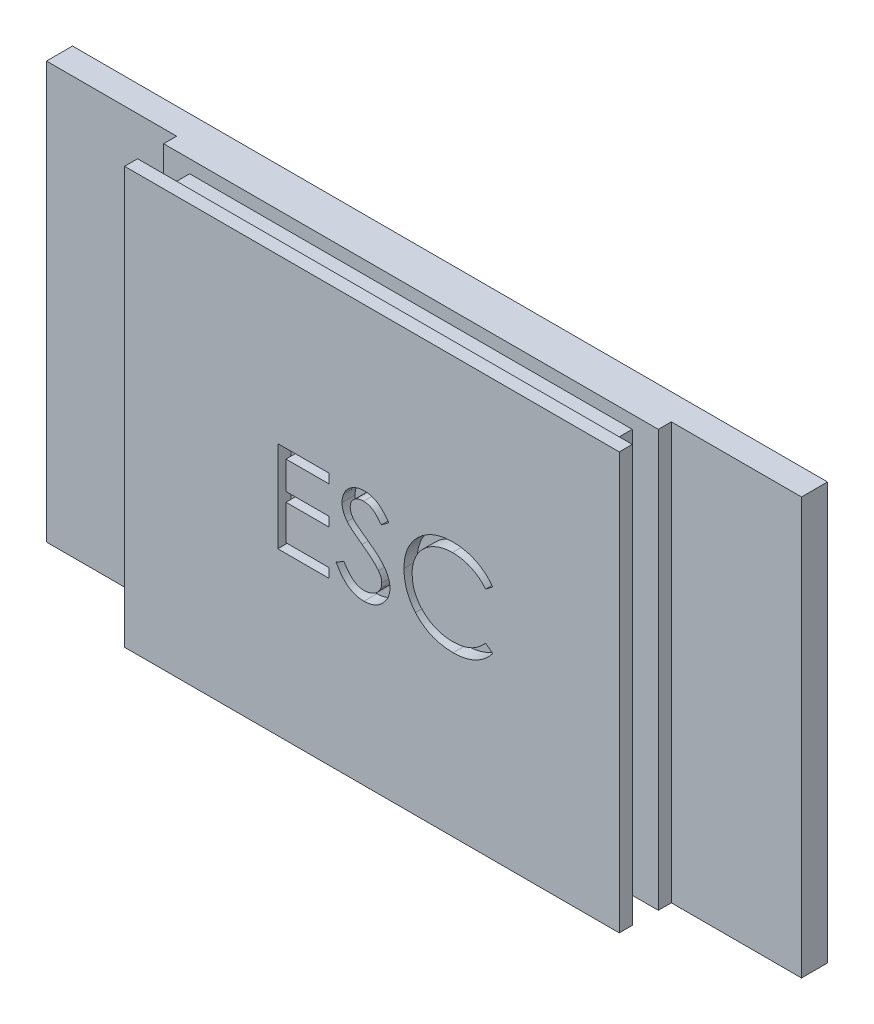
from build123d import *

# Parameters (mm, degrees)
SKETCH1_W           = 29
SKETCH1_H           = 16
BOSS_EXTRUDE2_DEPTH = 1
SKETCH3_W           = 19
SKETCH3_H           = 16
BOSS_EXTRUDE3_DEPTH = 2
SKETCH5_W           = 1
SKETCH5_H           = 16
CUT_EXTRUDE1_DEPTH  = 1
SKETCH7_W           = 1
SKETCH7_H           = 16
CUT_EXTRUDE2_DEPTH  = 1
SKETCH8_W           = 17
SKETCH8_H           = 1
CUT_EXTRUDE3_DEPTH  = 0.5
SKETCH9_W           = 17
SKETCH9_H           = 1
CUT_EXTRUDE4_DEPTH  = 0.5
CUT_EXTRUDE5_DEPTH  = 0.5


with BuildPart() as part:
    # Sketch1 → Boss-Extrude2 (new body)
    with BuildSketch(Plane.XY):
        Rectangle(SKETCH1_W, SKETCH1_H)
    extrude(amount=BOSS_EXTRUDE2_DEPTH)

    # Sketch3 → Boss-Extrude3 (add)
    with BuildSketch(Plane.XY.offset(1)):
        Rectangle(SKETCH3_W, SKETCH3_H)
    extrude(amount=BOSS_EXTRUDE3_DEPTH)

    # Sketch5 → Cut-Extrude1 (cut)
    with BuildSketch(Plane.ZY.offset(9.5)):
        with Locations((2, 0)):
            Rectangle(SKETCH5_W, SKETCH5_H)
    extrude(amount=-CUT_EXTRUDE1_DEPTH, mode=Mode.SUBTRACT)

    # Sketch7 → Cut-Extrude2 (cut)
    with BuildSketch(Plane(origin=(9.5, 0, 0), x_dir=(0, 0, -1), z_dir=(1, 0, 0))):
        with Locations((-2, 0)):
            Rectangle(SKETCH7_W, SKETCH7_H)
    extrude(amount=-CUT_EXTRUDE2_DEPTH, mode=Mode.SUBTRACT)

    # Sketch8 → Cut-Extrude3 (cut)
    with BuildSketch(Plane.XZ.offset(8)):
        with Locations((0, 2)):
            Rectangle(SKETCH8_W, SKETCH8_H)
    extrude(amount=-CUT_EXTRUDE3_DEPTH, mode=Mode.SUBTRACT)

    # Sketch9 → Cut-Extrude4 (cut)
    with BuildSketch(Plane(origin=(0, 8, 0), x_dir=(1, 0, 0), z_dir=(0, 1, 0))):
        with Locations((0, -2)):
            Rectangle(SKETCH9_W, SKETCH9_H)
    extrude(amount=-CUT_EXTRUDE4_DEPTH, mode=Mode.SUBTRACT)

    # Sketch10 → Cut-Extrude5 (cut)
    with BuildSketch(Plane.XY.offset(3)):
        Polygon((-3.615280491, 1.719214215), (-1.640921517, 1.719214215), (-1.640921517, 1.360239856), (-3.301177927, 1.360239856), (-3.301177927, 0.283316779), (-1.640921517, 0.283316779), (-1.640921517, -0.07565758), (-3.301177927, -0.07565758), (-3.301177927, -1.421811426), (-1.640921517, -1.421811426), (-1.640921517, -1.780785785), (-3.615280491, -1.780785785), align=None)
        with BuildLine():
            Line((-1.371690747, -1.105605497), (-1.07581735, -0.928221683))
            add(Edge.make_bspline(
                [(-1.07581735, -0.928221683), (-1.048299113, -0.974286068), (-0.995575232, -1.062543652), (-0.907623873, -1.181801692), (-0.816490962, -1.283163849), (-0.721501628, -1.366040456), (-0.62323568, -1.431289343), (-0.521051626, -1.477491575), (-0.415293816, -1.50630755), (-0.343319994, -1.509807637), (-0.307387863, -1.511555016)],
                knots=[0, 0, 0, 0, 1.272034388, 2.437168799, 3.508375237, 4.49857839, 5.41946034, 6.295179144, 7.148887113, 8, 8, 8, 8], degree=3))
            add(Edge.make_bspline(
                [(-0.307387863, -1.511555016), (-0.276701002, -1.510700344), (-0.215864229, -1.509005953), (-0.126301986, -1.492725151), (-0.039320184, -1.467713022), (0.043288454, -1.431892091), (0.120384068, -1.388553605), (0.187990764, -1.336207428), (0.246436877, -1.277601222), (0.294245991, -1.212218567), (0.330926027, -1.141901419), (0.359118095, -1.069725467), (0.374763169, -0.994556899), (0.377119922, -0.943946436), (0.378309253, -0.918405978)],
                knots=[0, 0, 0, 0, 1.095163259, 2.171163733, 3.241058638, 4.321873601, 5.38011039, 6.391990106, 7.366004449, 8.327778327, 9.272591725, 10.192022065, 11.087607919, 12, 12, 12, 12], degree=3))
            add(Edge.make_bspline(
                [(0.378309253, -0.918405978), (0.376834942, -0.889265128), (0.373837884, -0.830026039), (0.348506404, -0.742626386), (0.308657157, -0.656133816), (0.271894513, -0.60263255), (0.252808451, -0.574856298)],
                knots=[0, 0, 0, 0, 0.938893495, 1.908633276, 2.914225137, 4, 4, 4, 4], degree=3))
            add(Edge.make_bspline(
                [(0.252808451, -0.574856298), (0.237137837, -0.554809475), (0.204239343, -0.512723676), (0.14768183, -0.450078441), (0.081315716, -0.385460022), (0.007412161, -0.316400965), (-0.076720928, -0.246113168), (-0.168448442, -0.17124489), (-0.270112301, -0.094643313), (-0.341411798, -0.043270747), (-0.378201164, -0.016763349)],
                knots=[0, 0, 0, 0, 0.722233717, 1.516239348, 2.393582979, 3.351407094, 4.387010283, 5.505090956, 6.712668013, 8, 8, 8, 8], degree=3))
            add(Edge.make_bspline(
                [(-0.378201164, -0.016763349), (-0.41502516, 0.009465238), (-0.485429837, 0.0596123), (-0.583888419, 0.134036584), (-0.671932882, 0.202080454), (-0.749171899, 0.264384466), (-0.815571496, 0.320957071), (-0.871654907, 0.37125501), (-0.915993464, 0.416638571), (-0.940649044, 0.446079913), (-0.951718792, 0.459298349)],
                knots=[0, 0, 0, 0, 1.452282411, 2.77665338, 3.964542531, 5.026858415, 5.96415736, 6.766646006, 7.446254459, 8, 8, 8, 8], degree=3))
            add(Edge.make_bspline(
                [(-0.951718792, 0.459298349), (-0.967191337, 0.479899386), (-0.997620174, 0.52041409), (-1.03778618, 0.583738948), (-1.071925342, 0.648562213), (-1.098687675, 0.715058078), (-1.121223893, 0.782293006), (-1.136381824, 0.851144252), (-1.145873221, 0.921302871), (-1.146845208, 0.968516371), (-1.147331773, 0.992150913)],
                knots=[0, 0, 0, 0, 1.068054152, 2.10047183, 3.106115577, 4.101338837, 5.06977816, 6.043150881, 7.020423561, 8, 8, 8, 8], degree=3))
            add(Edge.make_bspline(
                [(-1.147331773, 0.992150913), (-1.146026564, 1.029180688), (-1.143444044, 1.102448752), (-1.121603527, 1.209479582), (-1.087130633, 1.311665999), (-1.038835745, 1.407996333), (-0.976578392, 1.495962314), (-0.904532418, 1.576575801), (-0.818720932, 1.644344383), (-0.724568308, 1.703556442), (-0.621511936, 1.749902367), (-0.513521033, 1.784863347), (-0.400423961, 1.804672605), (-0.323820826, 1.807515369), (-0.284951965, 1.808957804)],
                knots=[0, 0, 0, 0, 1.005424448, 1.989358655, 2.955360095, 3.929531133, 4.905563448, 5.876582895, 6.856512386, 7.866279853, 8.892233794, 9.918561126, 10.94386622, 12, 12, 12, 12], degree=3))
            add(Edge.make_bspline(
                [(-0.284951965, 1.808957804), (-0.243707865, 1.807535253), (-0.161686513, 1.804706252), (-0.041037298, 1.78010872), (0.075123419, 1.739408049), (0.168566683, 1.693219391), (0.241699445, 1.647087975), (0.297472178, 1.605068151), (0.353989628, 1.556693042), (0.411707683, 1.501833796), (0.469648343, 1.439987045), (0.528671795, 1.371576356), (0.588916064, 1.2970198), (0.627671924, 1.243795299), (0.647540022, 1.216509888)],
                knots=[0, 0, 0, 0, 1.286793592, 2.559021753, 3.825965368, 5.121522368, 5.803751409, 6.523245864, 7.299691795, 8.125521123, 9.008227632, 9.944561021, 10.946284179, 12, 12, 12, 12], degree=3))
            Line((0.647540022, 1.216509888), (0.363585695, 1.001265497))
            add(Edge.make_bspline(
                [(0.363585695, 1.001265497), (0.346439762, 1.023354187), (0.313420705, 1.06589184), (0.263291219, 1.125463156), (0.216042571, 1.179879635), (0.169492171, 1.227144763), (0.126098539, 1.269846897), (0.083981497, 1.306406654), (0.043747146, 1.337182249), (-0.006969765, 1.370025809), (-0.070687483, 1.402582313), (-0.150672019, 1.430131391), (-0.234258294, 1.446686453), (-0.291187926, 1.44887534), (-0.320008055, 1.449983445)],
                knots=[0, 0, 0, 0, 1.181633172, 2.275549214, 3.290209073, 4.226197932, 5.078386478, 5.862611352, 6.581680152, 7.217281963, 8.414376989, 9.595101626, 10.782541182, 12, 12, 12, 12], degree=3))
            add(Edge.make_bspline(
                [(-0.320008055, 1.449983445), (-0.356164577, 1.448771745), (-0.425889025, 1.446435096), (-0.524879261, 1.420915111), (-0.613973186, 1.380733251), (-0.690525751, 1.324418273), (-0.754262728, 1.25769728), (-0.800368187, 1.180918425), (-0.828118351, 1.096136022), (-0.831504631, 1.036994366), (-0.833229209, 1.006874471)],
                knots=[0, 0, 0, 0, 1.14458467, 2.207223713, 3.21896685, 4.227309161, 5.202851033, 6.127160689, 7.046193047, 8, 8, 8, 8], degree=3))
            add(Edge.make_bspline(
                [(-0.833229209, 1.006874471), (-0.832836082, 0.988122992), (-0.832049186, 0.950589373), (-0.821074389, 0.895137951), (-0.80697506, 0.839826612), (-0.784632428, 0.784904029), (-0.753787124, 0.72940967), (-0.713281948, 0.672387932), (-0.662268636, 0.613336224), (-0.623191624, 0.57492885), (-0.602560138, 0.554650913)],
                knots=[0, 0, 0, 0, 0.858281714, 1.717966888, 2.583508476, 3.4729293, 4.427298488, 5.488583878, 6.674047936, 8, 8, 8, 8], degree=3))
            add(Edge.make_bspline(
                [(-0.602560138, 0.554650913), (-0.594898766, 0.547813888), (-0.576697099, 0.531570679), (-0.543421173, 0.504978399), (-0.499478375, 0.472175626), (-0.446016174, 0.43158831), (-0.382048812, 0.384506848), (-0.307569256, 0.331533236), (-0.223407723, 0.270947777), (-0.163685807, 0.228590236), (-0.132107414, 0.206193381)],
                knots=[0, 0, 0, 0, 0.420754252, 0.999615792, 1.744751191, 2.668019286, 3.750313428, 4.999500688, 6.413464383, 8, 8, 8, 8], degree=3))
            add(Edge.make_bspline(
                [(-0.132107414, 0.206193381), (-0.094121501, 0.178552022), (-0.020567044, 0.12502836), (0.084090536, 0.04461268), (0.178984344, -0.034035089), (0.264447547, -0.110412696), (0.341324456, -0.183940789), (0.408762176, -0.255503969), (0.467447857, -0.324589542), (0.530627075, -0.413162117), (0.595184895, -0.521943202), (0.650626402, -0.65522144), (0.68558475, -0.789017761), (0.690156265, -0.878944597), (0.692411817, -0.92331383)],
                knots=[0, 0, 0, 0, 1.163667725, 2.253281268, 3.268753668, 4.215851969, 5.092017293, 5.902905408, 6.650798638, 7.335211899, 8.59617414, 9.77448103, 10.901945474, 12, 12, 12, 12], degree=3))
            add(Edge.make_bspline(
                [(0.692411817, -0.92331383), (0.691754679, -0.954692195), (0.690453164, -1.016839579), (0.67549225, -1.108094656), (0.653572585, -1.196725525), (0.620535351, -1.281636638), (0.580212192, -1.364381401), (0.529045944, -1.442789301), (0.46973826, -1.5185957), (0.401704495, -1.589779191), (0.327258593, -1.655125387), (0.248574898, -1.713254448), (0.165524625, -1.761722772), (0.078558308, -1.801273614), (-0.012344028, -1.832207131), (-0.107151812, -1.85462), (-0.206021324, -1.868375711), (-0.273221805, -1.869803473), (-0.307387863, -1.870529375)],
                knots=[0, 0, 0, 0, 0.983748083, 1.948392443, 2.894712957, 3.844097841, 4.80183111, 5.778335162, 6.776009319, 7.81870978, 8.863265674, 9.881300176, 10.883814829, 11.87499822, 12.874611388, 13.892143829, 14.928324115, 16, 16, 16, 16], degree=3))
            add(Edge.make_bspline(
                [(-0.307387863, -1.870529375), (-0.333823206, -1.870018194), (-0.386360966, -1.869002268), (-0.464070448, -1.860020988), (-0.540210037, -1.847313884), (-0.613824319, -1.827139814), (-0.685861731, -1.802662837), (-0.756008965, -1.772524504), (-0.824300019, -1.736407303), (-0.891117602, -1.695112278), (-0.956291776, -1.647054534), (-1.019211244, -1.591081037), (-1.08194043, -1.528735532), (-1.142627826, -1.458324969), (-1.20250097, -1.380986886), (-1.26037938, -1.295997703), (-1.317461098, -1.203820349), (-1.353276566, -1.138955263), (-1.371690747, -1.105605497)],
                knots=[0, 0, 0, 0, 0.915332311, 1.819136955, 2.706846663, 3.586547465, 4.459518054, 5.340707479, 6.227863349, 7.133153174, 8.059268498, 9.028702269, 10.047606654, 11.120612155, 12.245963614, 13.433783089, 14.680604001, 16, 16, 16, 16], degree=3))
        make_face()
        with BuildLine():
            Line((4.641129765, 1.076986651), (4.366290022, 0.866650112))
            add(Edge.make_bspline(
                [(4.366290022, 0.866650112), (4.346684133, 0.890016082), (4.307736687, 0.936432998), (4.245077484, 1.001612542), (4.179775841, 1.062677804), (4.11185672, 1.119919683), (4.040097601, 1.171336449), (3.966236802, 1.219607552), (3.889038757, 1.26287529), (3.782287022, 1.315338276), (3.642639174, 1.370084431), (3.466844335, 1.415987662), (3.283333236, 1.445208838), (3.158135637, 1.448373679), (3.094455086, 1.449983445)],
                knots=[0, 0, 0, 0, 0.757959112, 1.505699292, 2.245454638, 2.979532153, 3.711538275, 4.438200793, 5.171680507, 5.909471876, 7.393775596, 8.890124382, 10.418191784, 12, 12, 12, 12], degree=3))
            add(Edge.make_bspline(
                [(3.094455086, 1.449983445), (3.059371787, 1.449579483), (2.989530794, 1.448775307), (2.885882321, 1.438166182), (2.784169269, 1.423254972), (2.684457803, 1.401129649), (2.586874845, 1.373157029), (2.490782443, 1.339731616), (2.397571843, 1.298376776), (2.305953605, 1.252668516), (2.218174394, 1.201041071), (2.135119346, 1.144727719), (2.057091378, 1.084358623), (1.984028766, 1.019707516), (1.915856817, 0.951065556), (1.853069507, 0.877701214), (1.795884096, 0.799849041), (1.743167071, 0.718535633), (1.695954338, 0.633997842), (1.656424459, 0.545922771), (1.621419336, 0.455818668), (1.593720094, 0.362667507), (1.571795577, 0.267124741), (1.556667914, 0.168933953), (1.546179442, 0.068300274), (1.545379265, 9.0961e-05), (1.544975919, -0.034291394)],
                knots=[0, 0, 0, 0, 1.054917814, 2.100044995, 3.131103042, 4.146048494, 5.169673617, 6.183595914, 7.203665975, 8.234915748, 9.262203917, 10.264457458, 11.251630812, 12.227803204, 13.197192746, 14.159520551, 15.12972552, 16.100847026, 17.073214652, 18.039054194, 19.002613845, 19.979014051, 20.95965708, 21.949030935, 22.966165397, 24, 24, 24, 24], degree=3))
            add(Edge.make_bspline(
                [(1.544975919, -0.034291394), (1.546237738, -0.086022714), (1.548715153, -0.187590299), (1.570763487, -0.33636091), (1.604268578, -0.478881583), (1.654484155, -0.614261426), (1.716403205, -0.744169784), (1.794643817, -0.866408637), (1.885260354, -0.982825202), (1.989534774, -1.090668149), (2.10394059, -1.189181875), (2.226688501, -1.275932456), (2.357472789, -1.348247339), (2.494849419, -1.408423285), (2.639875533, -1.454680013), (2.792290336, -1.487244136), (2.951762331, -1.508486317), (3.060731731, -1.510520005), (3.116189862, -1.511555016)],
                knots=[0, 0, 0, 0, 1.029171465, 2.020641659, 2.987623507, 3.938342917, 4.889210282, 5.84687017, 6.821220943, 7.821438502, 8.827599549, 9.822697543, 10.807740252, 11.797342354, 12.80366471, 13.83203677, 14.896651826, 16, 16, 16, 16], degree=3))
            add(Edge.make_bspline(
                [(3.116189862, -1.511555016), (3.177292551, -1.509866236), (3.297557259, -1.506542314), (3.473925286, -1.478383065), (3.642761051, -1.432725147), (3.804073638, -1.368827225), (3.957408284, -1.285761937), (4.103004945, -1.185064059), (4.240986515, -1.065775727), (4.323957797, -0.974692598), (4.366290022, -0.928221683)],
                knots=[0, 0, 0, 0, 1.028121516, 2.023589091, 2.998037872, 3.967518031, 4.937445131, 5.927275754, 6.942489185, 8, 8, 8, 8], degree=3))
            Line((4.366290022, -0.928221683), (4.641129765, -1.136454856))
            add(Edge.make_bspline(
                [(4.641129765, -1.136454856), (4.619011656, -1.164993308), (4.57488138, -1.221933514), (4.503423363, -1.302205224), (4.428146066, -1.377709259), (4.348490356, -1.447836881), (4.265372564, -1.513991346), (4.177300252, -1.574293177), (4.085431219, -1.629584062), (3.990076741, -1.680210986), (3.891338128, -1.725128233), (3.789333693, -1.763582001), (3.684503117, -1.796706891), (3.576841609, -1.823958827), (3.466125852, -1.845229911), (3.352755378, -1.859449586), (3.236485503, -1.8691915), (3.158044082, -1.870079416), (3.118293227, -1.870529375)],
                knots=[0, 0, 0, 0, 0.986787822, 1.968848986, 2.935600012, 3.899624008, 4.868462664, 5.837806735, 6.815139263, 7.798259679, 8.787526145, 9.778297419, 10.776456485, 11.791383307, 12.812564526, 13.85620153, 14.913611965, 16, 16, 16, 16], degree=3))
            add(Edge.make_bspline(
                [(3.118293227, -1.870529375), (3.08064956, -1.870267383), (3.00621387, -1.869749325), (2.896315118, -1.861357157), (2.789325537, -1.84990742), (2.685550912, -1.832667289), (2.584424936, -1.812322949), (2.486864352, -1.785051693), (2.391909142, -1.754502526), (2.299940801, -1.718597539), (2.210881101, -1.678081357), (2.12501729, -1.632289798), (2.042388857, -1.581607933), (1.962183437, -1.527152923), (1.885585853, -1.467175621), (1.811932327, -1.402508986), (1.740809851, -1.333370976), (1.696807166, -1.283516122), (1.674683451, -1.258450048)],
                knots=[0, 0, 0, 0, 1.114604814, 2.203992996, 3.262667896, 4.300477797, 5.318619304, 6.316056647, 7.298880507, 8.271930387, 9.238335007, 10.195173496, 11.151986948, 12.108099108, 13.064862484, 14.031167946, 15.010108607, 16, 16, 16, 16], degree=3))
            add(Edge.make_bspline(
                [(1.674683451, -1.258450048), (1.639247808, -1.214908859), (1.568804331, -1.128352149), (1.478678647, -0.988066168), (1.401531092, -0.841597959), (1.339155171, -0.68817803), (1.290392438, -0.528150643), (1.256611243, -0.361435128), (1.234659639, -0.188187186), (1.23214935, -0.070350397), (1.230873355, -0.010453253)],
                knots=[0, 0, 0, 0, 0.994628077, 1.977248131, 2.950237994, 3.925870899, 4.908910175, 5.911660606, 6.938484602, 8, 8, 8, 8], degree=3))
            add(Edge.make_bspline(
                [(1.230873355, -0.010453253), (1.232428549, 0.0525022), (1.235488295, 0.176363125), (1.26148409, 0.358137078), (1.303302887, 0.532288477), (1.362699775, 0.698492222), (1.438005127, 0.857622502), (1.53103174, 1.008463707), (1.640698883, 1.151980506), (1.76614645, 1.285995258), (1.903713786, 1.40853461), (2.051032599, 1.516340814), (2.207814546, 1.60605833), (2.372332398, 1.681054492), (2.54581808, 1.738698955), (2.727901449, 1.779052142), (2.918240364, 1.804169258), (3.048102789, 1.807344466), (3.114086496, 1.808957804)],
                knots=[0, 0, 0, 0, 1.032925535, 2.032216505, 3.007276963, 3.968222605, 4.92396291, 5.891752235, 6.871517503, 7.883894988, 8.900124299, 9.891468569, 10.874487609, 11.85992873, 12.854644235, 13.869047385, 14.917252991, 16, 16, 16, 16], degree=3))
            add(Edge.make_bspline(
                [(3.114086496, 1.808957804), (3.154300968, 1.808475666), (3.233901465, 1.807521322), (3.351654118, 1.79821518), (3.466296445, 1.782701574), (3.577907427, 1.761585504), (3.687030043, 1.735378183), (3.792830284, 1.701237884), (3.895928971, 1.662201353), (3.995675879, 1.617242887), (4.091592429, 1.566776146), (4.183648748, 1.511360522), (4.271113606, 1.451064717), (4.354602455, 1.386401541), (4.432718666, 1.316002982), (4.507680144, 1.241805386), (4.576941223, 1.161671562), (4.619694418, 1.105266628), (4.641129765, 1.076986651)],
                knots=[0, 0, 0, 0, 1.096760587, 2.17092713, 3.219439832, 4.250915756, 5.268269357, 6.278326846, 7.281116186, 8.274029601, 9.260640565, 10.235837813, 11.203064059, 12.156899882, 13.114053108, 14.069676657, 15.032185724, 16, 16, 16, 16], degree=3))
        make_face()
    extrude(amount=-CUT_EXTRUDE5_DEPTH, mode=Mode.SUBTRACT)


solid = part.part
